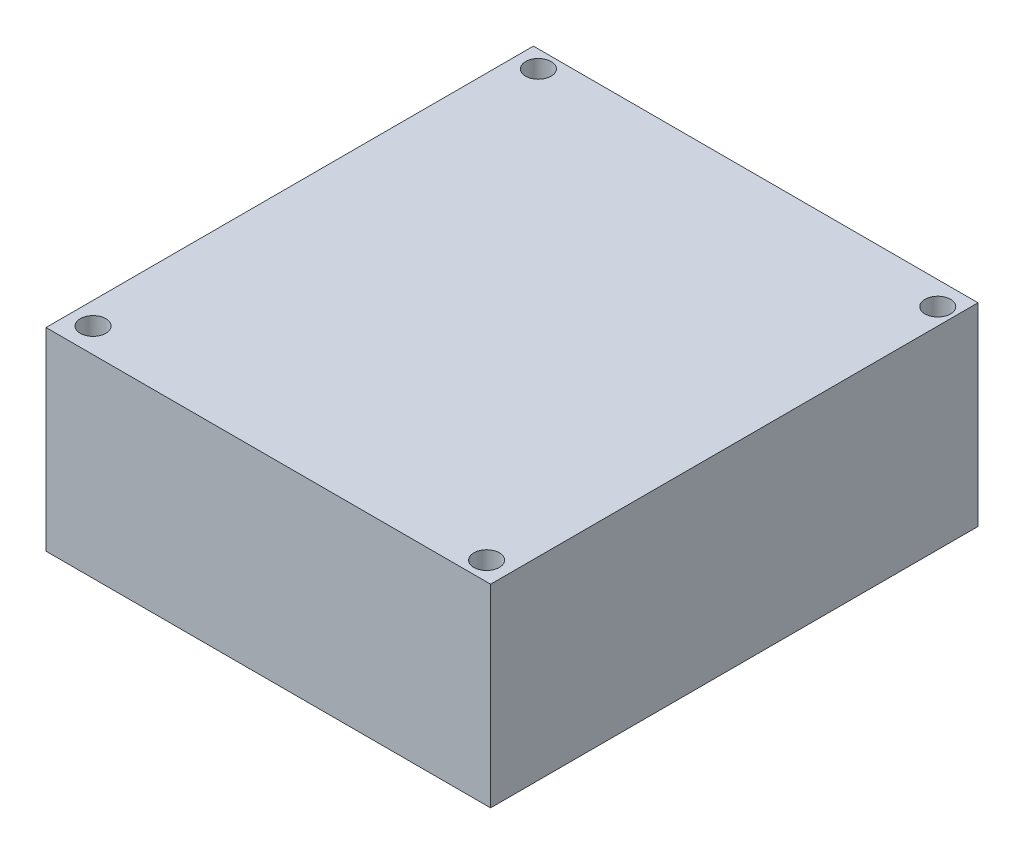
from build123d import *

# Parameters (mm, degrees)
ESQUISSE1_W             = 43.6
ESQUISSE1_H             = 47.8
BOSS_EXTRU_1_DEPTH      = 19
ESQUISSE2_R             = 1.25
ENL_V_MAT_EXTRU_1_DEPTH = 68.429963666


with BuildPart() as part:
    # Esquisse1 → Boss.-Extru.1 (new body)
    with BuildSketch(Plane(origin=(0, 0, 0), x_dir=(1, 0, 0), z_dir=(0, 1, 0))):
        with Locations((21.8, 23.9)):
            Rectangle(ESQUISSE1_W, ESQUISSE1_H)
    extrude(amount=BOSS_EXTRU_1_DEPTH)

    # Esquisse2 → Enlèv. mat.-Extru.1 (cut, through all)
    with BuildSketch(Plane(origin=(0, 19, 0), x_dir=(1, 0, 0), z_dir=(0, 1, 0))):
        with Locations(Location((2.177645576, 46.111134746, 0), (0, 0, 270))):
            Circle(ESQUISSE2_R)
        with Locations(Location((41.952188718, 45.502022041, 0), (0, 0, 270))):
            Circle(ESQUISSE2_R)
        with Locations(Location((41.361070963, 1.848446674, 0), (0, 0, 270))):
            Circle(ESQUISSE2_R)
        with Locations(Location((2.177645576, 2.435870362, 0), (0, 0, 270))):
            Circle(ESQUISSE2_R)
    extrude(amount=-ENL_V_MAT_EXTRU_1_DEPTH, mode=Mode.SUBTRACT)


solid = part.part
